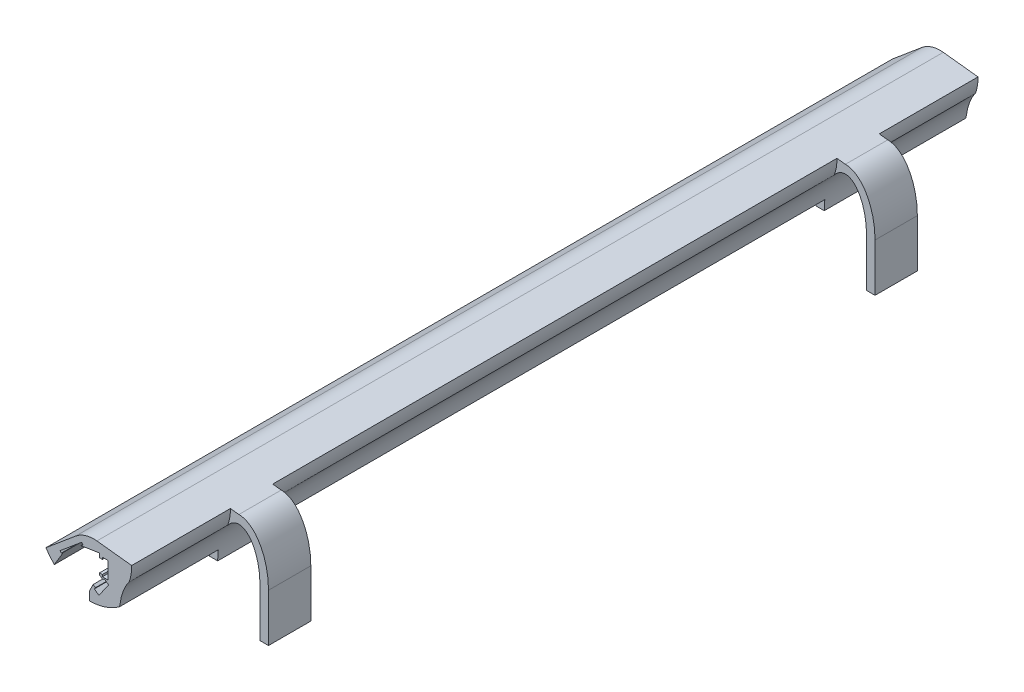
from build123d import *

# Parameters (mm, degrees)
EXTRUDE_7_DEPTH = 150
EXTRUDE_START   = 100
EXTRUDE_8_DEPTH = 15


with BuildPart() as part:
    # 草图1 → 凸台-拉伸7 (new body)
    with BuildSketch(Plane.XY):
        with BuildLine():
            Line((0, -15), (0, -18))
            ThreePointArc((0, -18), (5.639478957, -17.09374965), (10.711093494, -14.46625301))
            add(Edge.make_bspline(
                [(10.711093494, -14.46625301), (10.848513024, -13.332455818), (11.044833458, -12.194181271), (11.303579228, -11.074971651), (11.624303017, -10.001858622), (12.335244828, -8.106013793), (12.714420239, -7.26834028), (13.132516135, -6.504930588), (13.58190792, -5.828314757), (14.053066301, -5.245124167)],
                knots=[4.061743838, 4.061743838, 4.061743838, 4.061743838, 4.061743838, 4.061743838, 4.459501644, 4.459501644, 4.459501644, 4.459501644, 4.814431955, 4.814431955, 4.814431955, 4.814431955, 4.814431955, 4.814431955], degree=5, weights=[1, 1, 0.99989411, 0.999870278, 1, 1, 0.999879184, 0.999881196, 1, 1]))
            ThreePointArc((14.053066301, -5.245124167), (14.790408025, -2.498765784), (14.99620502, 0.337394434))
            Line((14.99620502, 0.337394434), (2.680600539, 1.720716673))
            ThreePointArc((2.680600539, 1.720716673), (-1.325193951, 1.356623757), (-4.863483604, -0.556347618))
            Line((-4.863483604, -0.556347618), (-15.368319993, -9.370951957))
            ThreePointArc((-15.368319993, -9.370951957), (-14.001248399, -11.31216351), (-12.390572928, -13.056557835))
            Line((-12.390572928, -13.056557835), (-9.192533317, -7.713451316))
            Line((-9.192533317, -7.713451316), (-9.958577761, -8.356238926))
            Line((-9.958577761, -8.356238926), (-10.408529087, -7.820007816))
            Line((-10.408529087, -7.820007816), (-2.748084656, -1.392131719))
            Line((-2.748084656, -1.392131719), (-2.298133329, -1.928362829))
            Line((-2.298133329, -1.928362829), (-3.064177772, -2.571150439))
            Line((-3.064177772, -2.571150439), (3.624750717, -1.5))
            Line((3.624750717, -1.5), (3.624750717, -3))
            Line((3.624750717, -3), (4.624750717, -3))
            Line((4.624750717, -3), (4.624750717, -2.3))
            Line((4.624750717, -2.3), (6.624750717, -2.3))
            Line((6.624750717, -2.3), (6.624750717, -8.3))
            Line((6.624750717, -8.3), (4.624750717, -8.3))
            Line((4.624750717, -8.3), (4.624750717, -7.6))
            Line((4.624750717, -7.6), (3.624750717, -7.6))
            Line((3.624750717, -7.6), (3.624750717, -8.3))
            Line((3.624750717, -8.3), (4.798277046, -9.121711982))
            Line((4.798277046, -9.121711982), (5.199780551, -8.54830555))
            Line((5.199780551, -8.54830555), (6.83808464, -9.695458423))
            Line((6.83808464, -9.695458423), (3.396626022, -14.610370689))
            Line((3.396626022, -14.610370689), (1.758321933, -13.463217816))
            Line((1.758321933, -13.463217816), (2.159825439, -12.889811385))
            Line((2.159825439, -12.889811385), (1.340673394, -12.316234949))
            Line((1.340673394, -12.316234949), (0, -15))
        make_face()
    extrude_7 = extrude(amount=EXTRUDE_7_DEPTH)

    # 草图5 → 凸台-拉伸8 (add)
    with BuildSketch(Plane.XY.offset(EXTRUDE_START)):
        with BuildLine():
            add(Edge.make_bspline(
                [(7.54460871, -16.342548131), (7.5, -17.169509918), (7.5, -18)],
                knots=[7.753410053, 7.753410053, 7.753410053, 7.853981634, 7.853981634, 7.853981634], degree=2, weights=[0.964895842, 0.981247261, 1]))
            Line((7.5, -18), (10.5, -18))
            add(Edge.make_bspline(
                [(10.711093494, -14.46625301), (10.5, -16.207906554), (10.5, -18)],
                knots=[4.459501644, 4.459501644, 4.459501644, 4.71238898, 4.71238898, 4.71238898], degree=2, weights=[0.920875303, 0.952846219, 1]))
            ThreePointArc((10.711093494, -14.46625301), (9.175935189, -15.485548535), (7.54460871, -16.342548131))
        make_face()
        with BuildLine():
            add(Edge.make_bspline(
                [(7.963401142, -12.711579062), (7.64454263, -14.489960749), (7.54460871, -16.342548131)],
                knots=[7.539833715, 7.539833715, 7.539833715, 7.753410053, 7.753410053, 7.753410053], degree=2, weights=[0.906276709, 0.930171557, 0.964895842]))
            ThreePointArc((7.54460871, -16.342548131), (9.175935189, -15.485548535), (10.711093494, -14.46625301))
            add(Edge.make_bspline(
                [(12, -9), (11.074485981, -11.468037385), (10.711093494, -14.46625301)],
                knots=[4.061743838, 4.061743838, 4.061743838, 4.459501644, 4.459501644, 4.459501644], degree=2, weights=[0.857864376, 0.870589347, 0.920875303]))
            ThreePointArc((12, -9), (10.152748449, -11.041815925), (7.963401142, -12.711579062))
        make_face()
        with BuildLine():
            add(Edge.make_bspline(
                [(17.746791844, -3.00855102), (15.751057332, -3.143384219), (14.053066301, -5.245124167)],
                knots=[3.178841958, 3.178841958, 3.178841958, 3.706813527, 3.706813527, 3.706813527], degree=2, weights=[0.986438278, 0.892660895, 0.865062576]))
            ThreePointArc((17.746791844, -3.00855102), (17.936586258, -1.509593787), (18, 0))
            add(Edge.make_bspline(
                [(18, 0), (16.457794493, 0), (14.980723149, -0.760219655)],
                knots=[6.283185307, 6.283185307, 6.283185307, 6.590751519, 6.590751519, 6.590751519], degree=2, weights=[1, 0.942650708, 0.907759712]))
            ThreePointArc((14.980723149, -0.760219655), (14.689071604, -3.038284946), (14.053066301, -5.245124167))
        make_face()
        with BuildLine():
            ThreePointArc((18, 0), (17.936586258, -1.509593787), (17.746791844, -3.00855102))
            add(Edge.make_bspline(
                [(25.5, -18), (25.5, -3), (18, -3), (17.873359825, -3), (17.746791844, -3.00855102)],
                knots=[1.570796327, 1.570796327, 1.570796327, 3.141592654, 3.141592654, 3.178841958, 3.178841958, 3.178841958], degree=2, weights=[1, 0.707106781, 1, 0.993054435, 0.986438278]))
            Line((25.5, -18), (25.5, -34.982946992))
            Line((25.5, -34.982946992), (28.5, -34.982946992))
            Line((28.5, -34.982946992), (28.5, -18))
            add(Edge.make_bspline(
                [(28.5, -18), (28.5, 0), (18, 0)],
                knots=[4.71238898, 4.71238898, 4.71238898, 6.283185307, 6.283185307, 6.283185307], degree=2, weights=[1, 0.707106781, 1]))
        make_face()
        with BuildLine():
            ThreePointArc((15, 0), (14.995180013, -0.380232008), (14.980723149, -0.760219655))
            add(Edge.make_bspline(
                [(18, 0), (16.457794493, 0), (14.980723149, -0.760219655)],
                knots=[6.283185307, 6.283185307, 6.283185307, 6.590751519, 6.590751519, 6.590751519], degree=2, weights=[1, 0.942650708, 0.907759712]))
            Line((18, 0), (14.99620502, 0.337394434))
            ThreePointArc((14.99620502, 0.337394434), (14.999051225, 0.168707888), (15, 0))
        make_face()
    extrude_8 = extrude(amount=EXTRUDE_8_DEPTH)

    # 镜向1: 凸台-拉伸7, 凸台-拉伸8 across plane
    add(extrude_7.mirror(Plane.XY))
    add(extrude_8.mirror(Plane.XY))


solid = part.part
